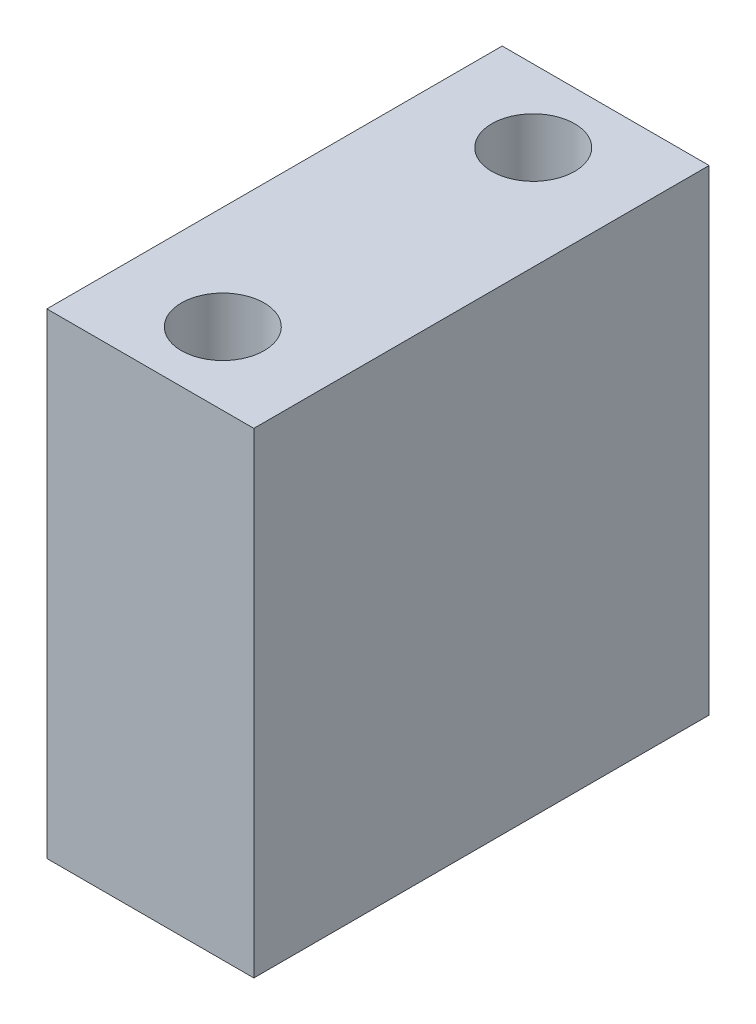
from build123d import *

# Parameters (mm, degrees)
SKETCH1_W           = 10
SKETCH1_H           = 22
SKETCH1_R           = 2
BOSS_EXTRUDE1_DEPTH = 23


with BuildPart() as part:
    # Sketch1 → Boss-Extrude1 (new body)
    with BuildSketch(Plane(origin=(0, 0, 0), x_dir=(1, 0, 0), z_dir=(0, 1, 0))):
        Rectangle(SKETCH1_W, SKETCH1_H)
        with Locations(Location((0, 7.5, 0), (0, 0, 270))):
            Circle(SKETCH1_R, mode=Mode.SUBTRACT)
        with Locations(Location((0, -7.5, 0), (0, 0, 270))):
            Circle(SKETCH1_R, mode=Mode.SUBTRACT)
    extrude(amount=BOSS_EXTRUDE1_DEPTH)


solid = part.part
